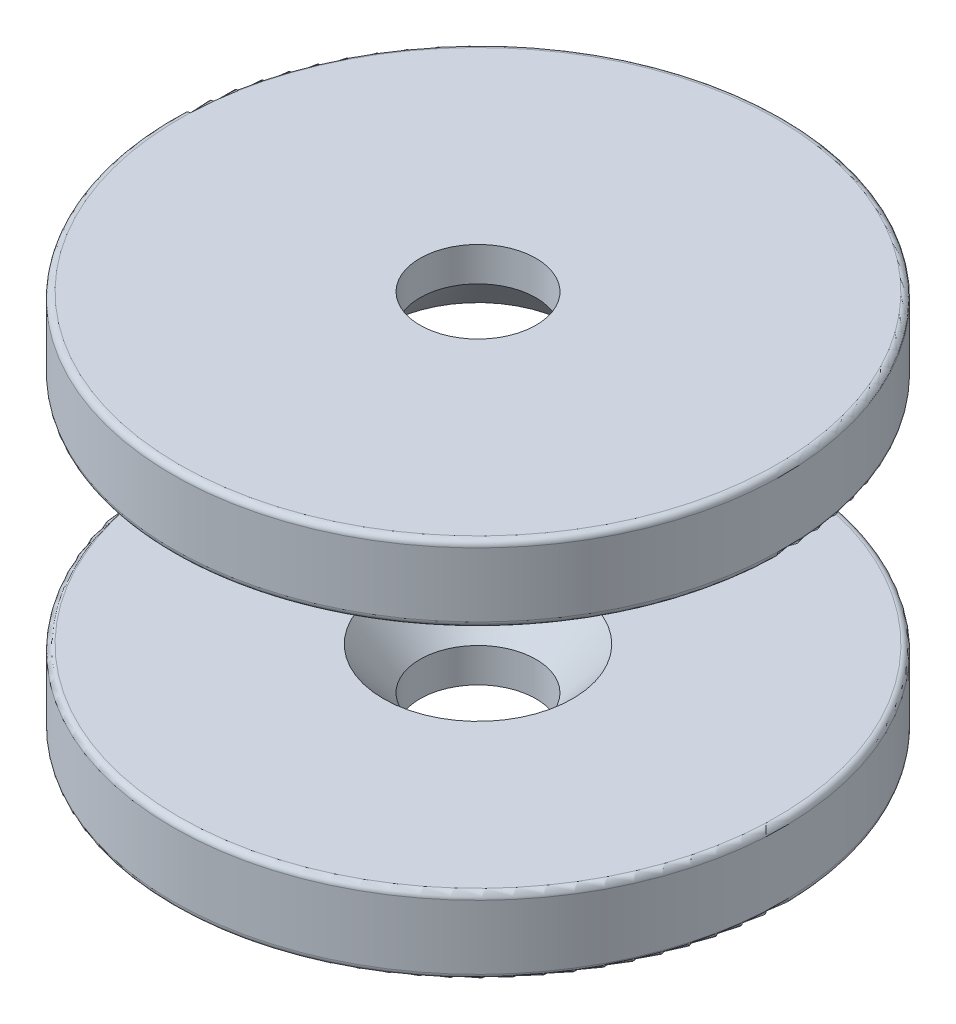
from build123d import *

# Parameters (mm, degrees)
SKETCH1_R             = 12.7
SKETCH1_R_2           = 2.413
BOSS_EXTRUDE1_DEPTH   = 1.5875
FILLET1_R             = 0.254
BODY_MOVE_COPY1_ANGLE = 180


with BuildPart() as part:
    # Sketch1 → Boss-Extrude1 (new, symmetric)
    with BuildSketch(Plane(origin=(0, 0, 0), x_dir=(1, 0, 0), z_dir=(0, 1, 0))):
        Circle(SKETCH1_R)
        Circle(SKETCH1_R_2, mode=Mode.SUBTRACT)
    extrude(amount=BOSS_EXTRUDE1_DEPTH, both=True)

    # Fillet1
    fillet1_edges = [part.edges().sort_by_distance(p)[0] for p in [
        (-12.7, -1.5875, 0),
        (-12.7, 1.5875, 0),
    ]]
    fillet(fillet1_edges, radius=FILLET1_R)

    # Cut-Extrude1 cone 1 section (through the dimple's axis) → Cut-Extrude1 (revolve, cut)
    with BuildSketch(Plane(origin=(0, 1.5875, 0), x_dir=(0, 0, 1), z_dir=(1, 0, 0))):
        Polygon((0, 0), (3.937, 0), (0, 4.529000419), align=None)
    revolve(axis=Axis((0, 1.5875, 0), (0, -1, 0)), mode=Mode.SUBTRACT)


with BuildPart() as body_2:
    # Body-Move/Copy1: copy of part
    add(part.part.rotate(Axis((0, 0, 0), (1, 0, 0)), BODY_MOVE_COPY1_ANGLE))


with BuildPart() as body_2_1:
    # Body-Move/Copy2: moved
    add(body_2.part.moved(Location((0, 12.7, 0))))


solid = Compound([part.part, body_2_1.part])
